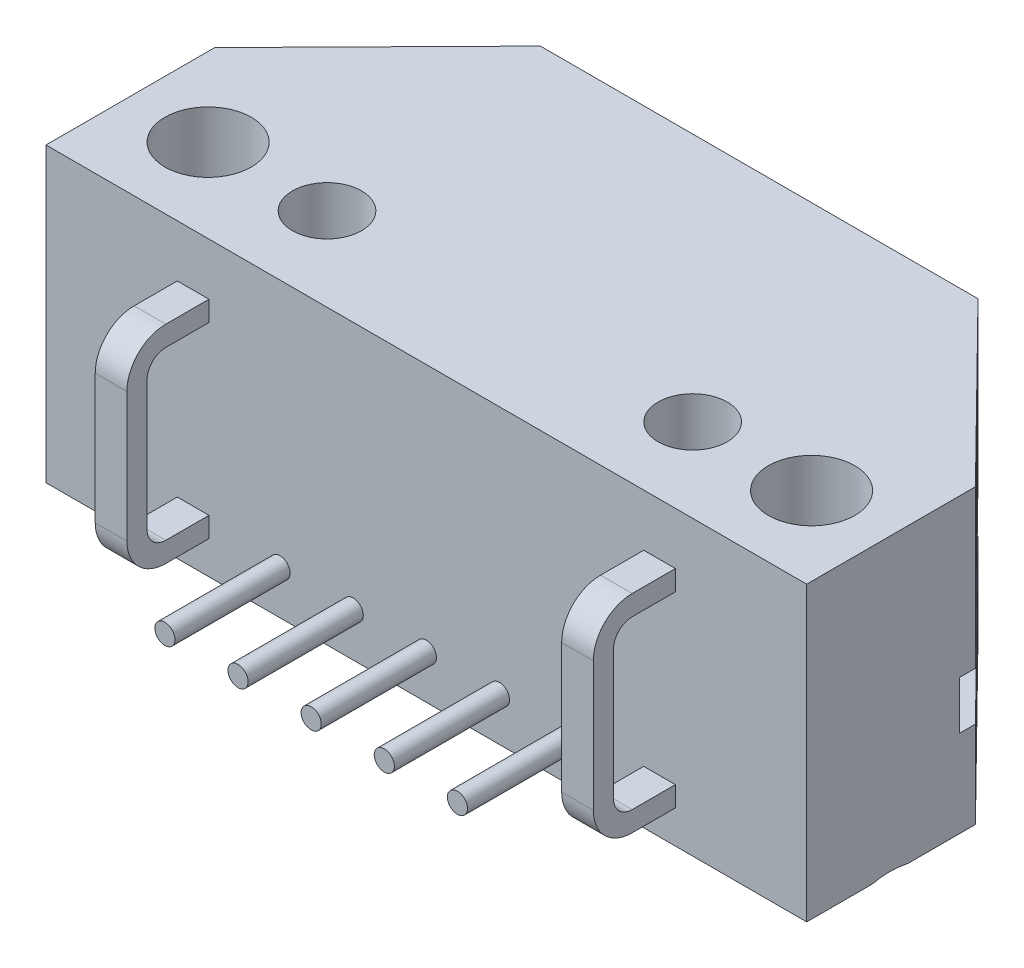
from build123d import *

# Parameters (mm, degrees)
AUFSATZ_LINEAR_AUSTRAGEN1_DEPTH                      = 6.74
AUFSATZ_LINEAR_AUSTRAGEN1_DEPTH_BACK                 = 3.42
SKIZZE1_R                                            = 1.385
SCHNITT_LINEAR_AUSTRAGEN1_DEPTH                      = 24.827593248
SCHNITT_LINEAR_AUSTRAGEN1_DEPTH_BACK                 = 24.827593248
SKIZZE2_W                                            = 16.035180953
SKIZZE2_H                                            = 1.68
SKIZZE3_R                                            = 1.2
SCHNITT_LINEAR_AUSTRAGEN2_DEPTH                      = 2.16
SKIZZE4_R                                            = 0.35
AUFSATZ_LINEAR_AUSTRAGEN2_DEPTH                      = 4
LINEAR_AUSTRAGEN_D_NN1_DEPTH                         = 0.55
FORMSENKUNG_F_R_M3_SENKSCHRAUBE_MIT_SCHL_D           = 3
FORMSENKUNG_F_R_M3_SENKSCHRAUBE_MIT_SCHL_DEPTH       = 11
FORMSENKUNG_F_R_M3_SENKSCHRAUBE_MIT_SCHL_CSINK_D     = 5.6
FORMSENKUNG_F_R_M3_SENKSCHRAUBE_MIT_SCHL_CSINK_ANGLE = 90
FORMSENKUNG_F_R_M3_SENKSCHRAUBE_MIT_SCHL_TIP         = 0.901290929


with BuildPart() as part:
    # Skizze1 → Aufsatz-Linear austragen1 (new, two sides: drawn at the far end of the back side and taken through both)
    with BuildSketch(Plane(origin=(0, 0, 0), x_dir=(1, 0, 0), z_dir=(0, 1, 0)).offset(-AUFSATZ_LINEAR_AUSTRAGEN1_DEPTH_BACK)):
        Polygon((-13.21, -18.65), (-13.21, -12.79), (-7.6, -7.09), (7.6, -7.09), (13.21, -12.79), (13.21, -18.65), align=None)
        with Locations(Location((-10.48, -15.75, 0), (0, 0, 270))):
            Circle(SKIZZE1_R, mode=Mode.SUBTRACT)
        with Locations(Location((10.48, -15.75, 0), (0, 0, 90))):
            Circle(SKIZZE1_R, mode=Mode.SUBTRACT)
    extrude(amount=AUFSATZ_LINEAR_AUSTRAGEN1_DEPTH + AUFSATZ_LINEAR_AUSTRAGEN1_DEPTH_BACK)

    # Skizze2 → Schnitt-Linear austragen1 (cut, two sides: drawn at the far end of the back side and taken through both)
    with BuildSketch(Plane(origin=(0, 0, 0), x_dir=(0, 0, -1), z_dir=(1, 0, 0)).offset(-SCHNITT_LINEAR_AUSTRAGEN1_DEPTH_BACK)):
        with Locations((-5.332409524, 0.44)):
            Rectangle(SKIZZE2_W, SKIZZE2_H)
    extrude(amount=SCHNITT_LINEAR_AUSTRAGEN1_DEPTH + SCHNITT_LINEAR_AUSTRAGEN1_DEPTH_BACK, mode=Mode.SUBTRACT)

    # Skizze3 → Schnitt-Linear austragen2 (cut)
    with BuildSketch(Plane(origin=(0, 6.74, 0), x_dir=(1, 0, 0), z_dir=(0, 1, 0))):
        with Locations(Location((6.35, -15.75, 0), (0, 0, 270))):
            Circle(SKIZZE3_R)
        with Locations(Location((-6.35, -15.75, 0), (0, 0, 90))):
            Circle(SKIZZE3_R)
    extrude(amount=-SCHNITT_LINEAR_AUSTRAGEN2_DEPTH, mode=Mode.SUBTRACT)

    # Skizze4 → Aufsatz-Linear austragen2 (add)
    with BuildSketch(Plane.XY.offset(18.65)):
        with Locations((0, -1.9)):
            Circle(SKIZZE4_R)
        with Locations((2.54, -1.9)):
            Circle(SKIZZE4_R)
        with Locations((5.08, -1.9)):
            Circle(SKIZZE4_R)
        with Locations(Location((-2.54, -1.9, 0), (0, 0, 180))):
            Circle(SKIZZE4_R)
        with Locations(Location((-5.08, -1.9, 0), (0, 0, 180))):
            Circle(SKIZZE4_R)
    extrude(amount=AUFSATZ_LINEAR_AUSTRAGEN2_DEPTH)

    # Skizze5 → Linear-Austragen-Dünn1 (add, symmetric)
    with BuildSketch(Plane(origin=(8.1, 0, 0), x_dir=(0, 0, -1), z_dir=(1, 0, 0))):
        with BuildLine():
            Line((-18.65, -1.57), (-20.15, -1.57))
            ThreePointArc((-20.15, -1.57), (-20.609619408, -1.379619408), (-20.8, -0.92))
            Line((-20.8, -0.92), (-20.8, 3.58))
            ThreePointArc((-20.8, 3.58), (-20.609619408, 4.039619408), (-20.15, 4.23))
            Line((-20.15, 4.23), (-18.65, 4.23))
            Line((-18.65, 4.23), (-18.65, 4.93))
            Line((-18.65, 4.93), (-20.15, 4.93))
            ThreePointArc((-20.15, 4.93), (-21.104594155, 4.534594155), (-21.5, 3.58))
            Line((-21.5, 3.58), (-21.5, -0.92))
            ThreePointArc((-21.5, -0.92), (-21.104594155, -1.874594155), (-20.15, -2.27))
            Line((-20.15, -2.27), (-18.65, -2.27))
            Line((-18.65, -2.27), (-18.65, -1.57))
        make_face()
    linear_austragen_d_nn1 = extrude(amount=LINEAR_AUSTRAGEN_D_NN1_DEPTH, both=True)

    # Spiegeln1: Linear-Austragen-Dünn1 across plane
    add(linear_austragen_d_nn1.mirror(Plane(origin=(0, 0, 0), x_dir=(0, 0, 1), z_dir=(1, 0, 0))))

    # Formsenkung für M3 Senkschraube mit Schlitz/Kreuzschlitz1
    with Locations(Plane(origin=(0, -3.42, 0), x_dir=(-1, 0, 0), z_dir=(0, -1, 0))):
        with Locations((-10.48, -15.75), (10.48, -15.75)):
            CounterSinkHole(FORMSENKUNG_F_R_M3_SENKSCHRAUBE_MIT_SCHL_D / 2, FORMSENKUNG_F_R_M3_SENKSCHRAUBE_MIT_SCHL_CSINK_D / 2, depth=FORMSENKUNG_F_R_M3_SENKSCHRAUBE_MIT_SCHL_DEPTH, counter_sink_angle=FORMSENKUNG_F_R_M3_SENKSCHRAUBE_MIT_SCHL_CSINK_ANGLE)
            with Locations((0, 0, -(FORMSENKUNG_F_R_M3_SENKSCHRAUBE_MIT_SCHL_DEPTH + FORMSENKUNG_F_R_M3_SENKSCHRAUBE_MIT_SCHL_TIP / 2))):  # 118° drill point
                Cone(0, FORMSENKUNG_F_R_M3_SENKSCHRAUBE_MIT_SCHL_D / 2, FORMSENKUNG_F_R_M3_SENKSCHRAUBE_MIT_SCHL_TIP, mode=Mode.SUBTRACT)


solid = part.part
